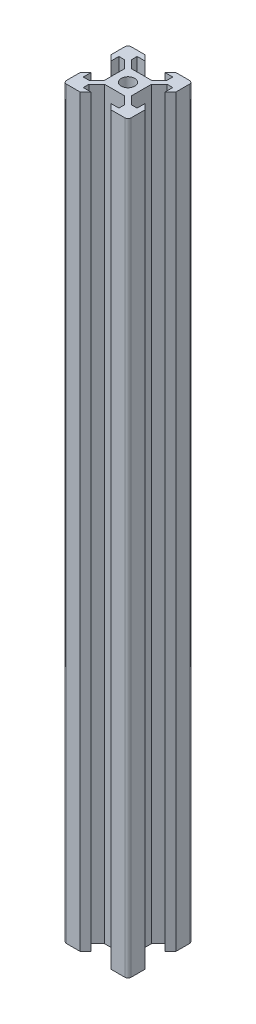
from build123d import *

# Parameters (mm, degrees)
MASTERLAYOUTSKETCH_R = 2.1
MAIN_EXTRUSION_DEPTH = 230
EDGE_FILLETS_R       = 1


with BuildPart() as part:
    # MasterLayoutSketch → Main Extrusion (new body)
    with BuildSketch(Plane(origin=(0, 0, 0), x_dir=(1, 0, 0), z_dir=(0, 1, 0))):
        Polygon((-8.325, 3.1), (-8.325, 5.5), (-6.560660172, 5.5), (-4.160660172, 3.1), (-4.160660172, -3.1), (-6.560660172, -5.5), (-8.325, -5.5), (-8.325, -3.1), (-10, -4.775), (-10, -10), (-4.775, -10), (-3.1, -8.325), (-5.5, -8.325), (-5.5, -6.560660172), (-3.1, -4.160660172), (3.1, -4.160660172), (5.5, -6.560660172), (5.5, -8.325), (3.1, -8.325), (4.775, -10), (10, -10), (10, -4.775), (8.325, -3.1), (8.325, -5.5), (6.560660172, -5.5), (4.160660172, -3.1), (4.160660172, 3.1), (6.560660172, 5.5), (8.325, 5.5), (8.325, 3.1), (10, 4.775), (10, 10), (4.775, 10), (3.1, 8.325), (5.5, 8.325), (5.5, 6.560660172), (3.1, 4.160660172), (-3.1, 4.160660172), (-5.5, 6.560660172), (-5.5, 8.325), (-3.1, 8.325), (-4.775, 10), (-10, 10), (-10, 4.775), align=None)
        with Locations(Location((0, 0, 0), (0, 0, 270))):
            Circle(MASTERLAYOUTSKETCH_R, mode=Mode.SUBTRACT)
    extrude(amount=MAIN_EXTRUSION_DEPTH)

    # Edge Fillets
    edge_fillets_edges = [part.edges().sort_by_distance(p)[0] for p in [
        (10, 115, -10),
        (10, 115, 10),
        (-10, 115, 10),
        (-10, 115, -10),
    ]]
    fillet(edge_fillets_edges, radius=EDGE_FILLETS_R)


solid = part.part
